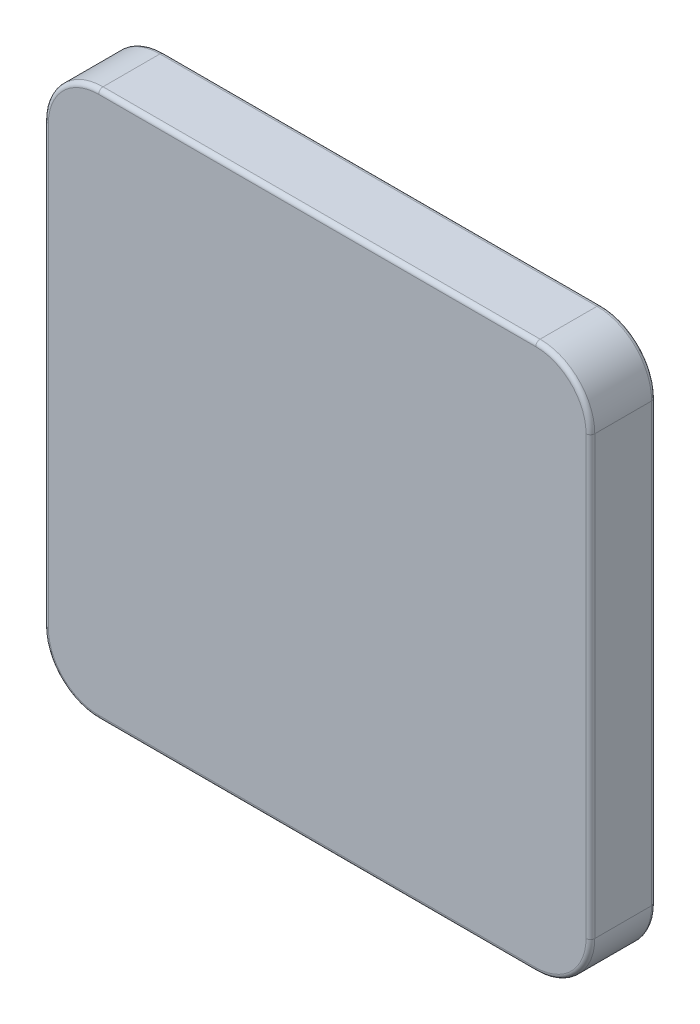
from build123d import *

# Parameters (mm, degrees)
BOSS_EXTRUDE1_DEPTH = 304.8
FILLET2_R           = 20.32
FILLET3_R           = 20.32


with BuildPart() as part:
    # Sketch1 → Boss-Extrude1 (new body)
    with BuildSketch(Plane.XY):
        with BuildLine():
            Line((-1016, 1270), (1016, 1270))
            ThreePointArc((1016, 1270), (1195.605122421, 1195.605122421), (1270, 1016))
            Line((1270, 1016), (1270, -1016))
            ThreePointArc((1270, -1016), (1195.605122421, -1195.605122421), (1016, -1270))
            Line((1016, -1270), (-1016, -1270))
            ThreePointArc((-1016, -1270), (-1195.605122421, -1195.605122421), (-1270, -1016))
            Line((-1270, -1016), (-1270, 1016))
            ThreePointArc((-1270, 1016), (-1195.605122421, 1195.605122421), (-1016, 1270))
        make_face()
    extrude(amount=BOSS_EXTRUDE1_DEPTH)

    # Fillet2
    fillet2_edges = [part.edges().sort_by_distance(p)[0] for p in [
        (-1195.605122421, -1195.605122421, 304.8),
        (0, -1270, 304.8),
        (1195.605122421, -1195.605122421, 304.8),
        (1270, 0, 304.8),
        (1195.605122421, 1195.605122421, 304.8),
        (0, 1270, 304.8),
        (-1195.605122421, 1195.605122421, 304.8),
        (-1270, 0, 304.8),
    ]]
    fillet(fillet2_edges, radius=FILLET2_R)

    # Fillet3
    fillet3_edges = [part.edges().sort_by_distance(p)[0] for p in [
        (0, -1270, 0),
        (-1195.605122421, -1195.605122421, 0),
        (-1270, 0, 0),
        (-1195.605122421, 1195.605122421, 0),
        (0, 1270, 0),
        (1195.605122421, 1195.605122421, 0),
        (1270, 0, 0),
        (1195.605122421, -1195.605122421, 0),
    ]]
    fillet(fillet3_edges, radius=FILLET3_R)


solid = part.part
